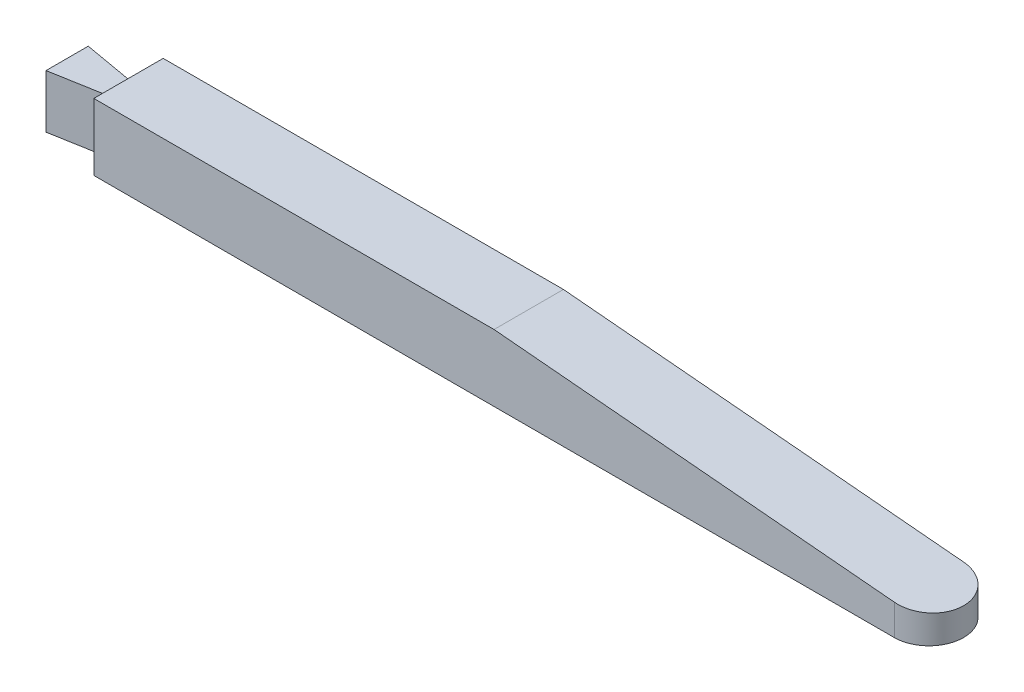
from build123d import *

# Parameters (mm, degrees)
BOSS_EXTRUDE1_DEPTH = 38.1
CUT_EXTRUDE1_DEPTH  = 7.62
CUT_EXTRUDE4_DEPTH  = 39.624


with BuildPart() as part:
    # Sketch2 → Boss-Extrude1 (new body)
    with BuildSketch(Plane(origin=(0, 0, 0), x_dir=(1, 0, 0), z_dir=(0, 1, 0))):
        with BuildLine():
            Line((-13.549240888, -8.64489), (-13.549240888, -32.77489))
            Line((-13.549240888, -32.77489), (21.502759112, -26.594276672))
            Line((21.502759112, -26.594276672), (21.502759112, -40.52189))
            Line((21.502759112, -40.52189), (478.702759112, -40.52189))
            ThreePointArc((478.702759112, -40.52189), (498.514759112, -20.70989), (478.702759112, -0.89789))
            Line((478.702759112, -0.89789), (21.502759112, -0.89789))
            Line((21.502759112, -0.89789), (21.502759112, -14.825503328))
            Line((21.502759112, -14.825503328), (-13.549240888, -8.64489))
        make_face()
    extrude(amount=BOSS_EXTRUDE1_DEPTH)

    # Sketch3 → Cut-Extrude1 (cut)
    with BuildSketch(Plane(origin=(0, 38.1, 0), x_dir=(1, 0, 0), z_dir=(0, 1, 0))):
        Polygon((-13.549240888, -8.64489), (-13.549240888, -32.77489), (21.502759112, -26.594276672), (21.502759112, -14.825503328), align=None)
    extrude(amount=-CUT_EXTRUDE1_DEPTH, mode=Mode.SUBTRACT)

    # Sketch5 → Cut-Extrude4 (cut)
    with BuildSketch(Plane.XY.offset(40.52189)):
        Polygon((250.102759112, 38.1), (498.514759112, 15.775221318), (498.514759112, 38.1), align=None)
    extrude(amount=-CUT_EXTRUDE4_DEPTH, mode=Mode.SUBTRACT)


solid = part.part
